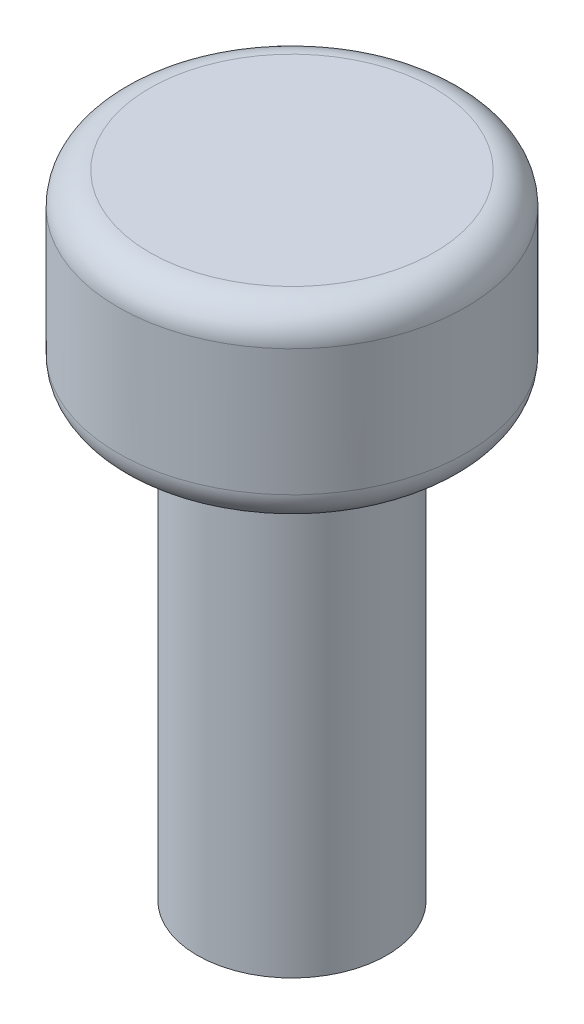
from build123d import *

# Parameters (mm, degrees)
FILLET1_R = 0.5


with BuildPart() as part:
    # Sketch1 → Revolve1 (revolve)
    with BuildSketch(Plane.XY, mode=Mode.PRIVATE) as revolve1_sk:
        Polygon((0, 0), (1.5, 0), (1.5, 7), (2.75, 7), (2.75, 10), (0, 10), (0, 7), align=None)
    revolve(revolve1_sk.sketch.rotate(Axis((0, 0, 0), (0, 1, 0)), 90), axis=Axis((0, 0, 0), (0, 1, 0)))

    # Fillet1
    fillet1_edges = [part.edges().sort_by_distance(p)[0] for p in [
        (0, 7, 2.75),
        (0, 10, 2.75),
    ]]
    fillet(fillet1_edges, radius=FILLET1_R)


solid = part.part
